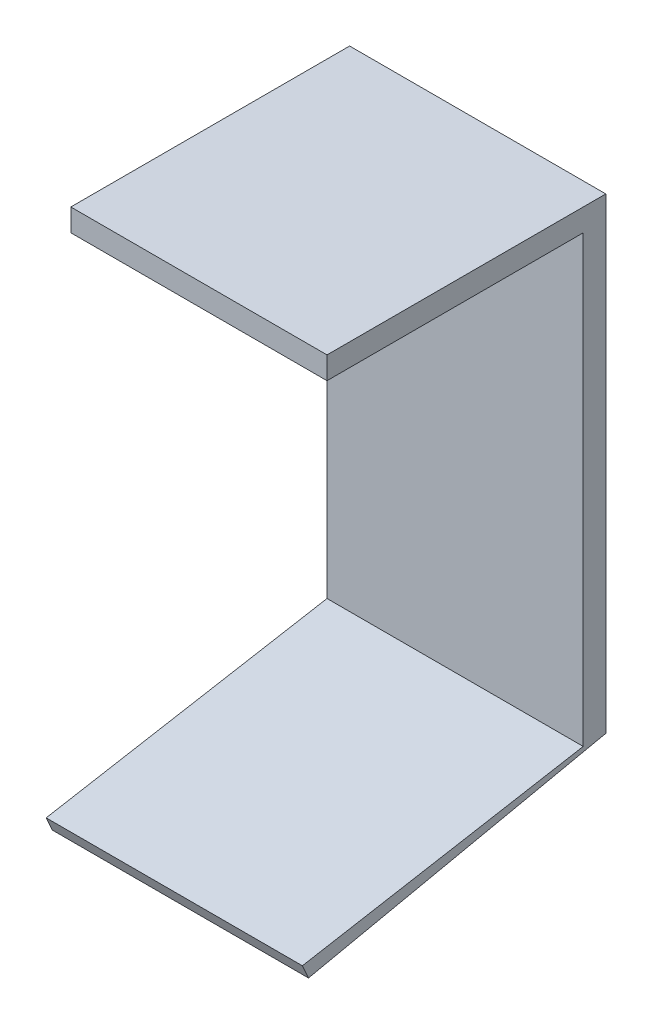
from build123d import *

# Parameters (mm, degrees)
SKETCH1_W           = 68
SKETCH1_H           = 6
BOSS_EXTRUDE1_DEPTH = 124
BOSS_EXTRUDE2_DEPTH = 68
SKETCH4_W           = 68
SKETCH4_H           = 5.93639456
BOSS_EXTRUDE3_DEPTH = 68


with BuildPart() as part:
    # Sketch1 → Boss-Extrude1 (new body)
    with BuildSketch(Plane(origin=(0, 0, 0), x_dir=(1, 0, 0), z_dir=(0, 1, 0))):
        with Locations((34, 3)):
            Rectangle(SKETCH1_W, SKETCH1_H)
    extrude(amount=BOSS_EXTRUDE1_DEPTH)

    # Sketch3 → Boss-Extrude2 (add)
    with BuildSketch(Plane(origin=(0, 0, 0), x_dir=(0, 0, -1), z_dir=(1, 0, 0))):
        Polygon((0, 0), (-74.536565036, -13.142807465), (-72.911197136, -16.77309274), (6, 0), align=None)
    extrude(amount=BOSS_EXTRUDE2_DEPTH)

    # Sketch4 → Boss-Extrude3 (add)
    with BuildSketch(Plane.XY):
        with Locations((34, 121.03180272)):
            Rectangle(SKETCH4_W, SKETCH4_H)
    extrude(amount=BOSS_EXTRUDE3_DEPTH)


solid = part.part
